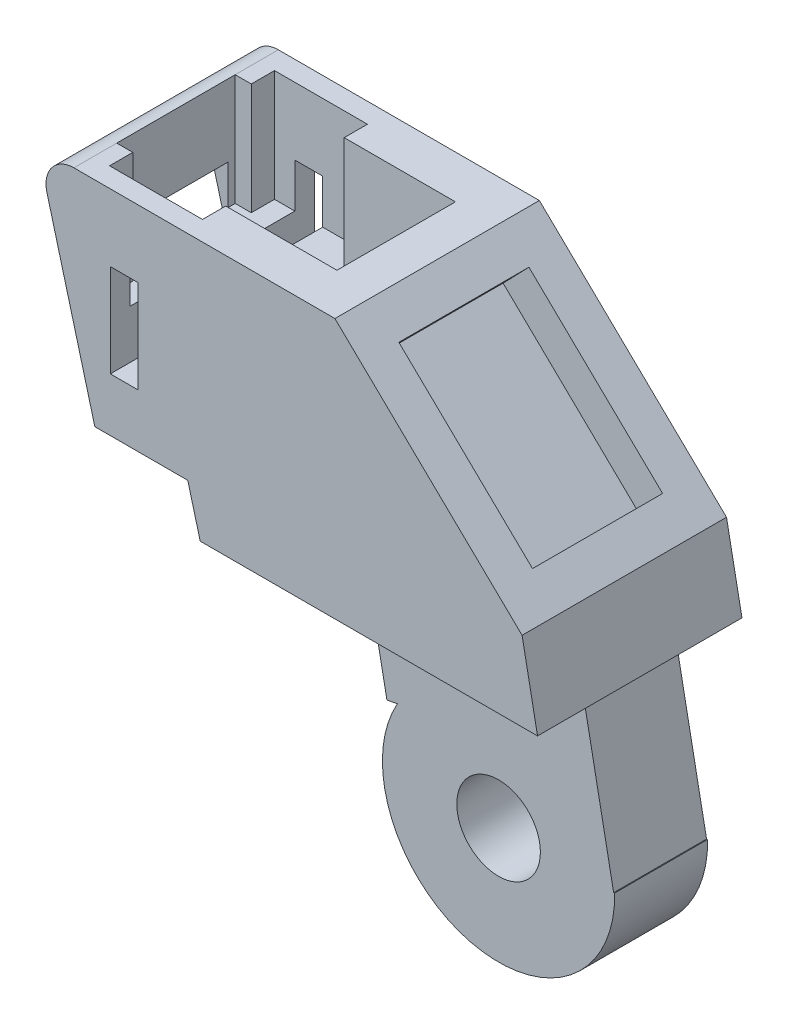
from build123d import *

# Parameters (mm, degrees)
SKETCH1_R                = 12.499992756
SKETCH1_R_2              = 4.5
BOSS_EXTRUDE1_DEPTH      = 10
BOSS_EXTRUDE2_DEPTH      = 11
BOSS_EXTRUDE2_DEPTH_BACK = 11
SKETCH7_W                = 11.132946344
SKETCH7_H                = 10.716090789
CUT_EXTRUDE1_DEPTH       = 24
CUT_EXTRUDE2_DEPTH       = 12
SKETCH9_W                = 20
SKETCH9_H                = 14
CUT_EXTRUDE3_DEPTH       = 4
SKETCH11_W               = 3
SKETCH11_H               = 10
CUT_EXTRUDE6_DEPTH       = 29
CUT_EXTRUDE7_DEPTH       = 6
CUT_EXTRUDE8_DEPTH       = 6
SKETCH14_W               = 10
SKETCH14_H               = 16.627390186
CUT_EXTRUDE11_DEPTH      = 1


with BuildPart() as part:
    # Sketch1 → Boss-Extrude1 (new body)
    with BuildSketch(Plane.XY):
        with Locations((-2.359227986, 3.370325694)):
            Circle(SKETCH1_R)
        with Locations((-2.359227986, 3.370325694)):
            Circle(SKETCH1_R_2, mode=Mode.SUBTRACT)
    extrude(amount=BOSS_EXTRUDE1_DEPTH)

    # Sketch2 → Boss-Extrude2 (add, two sides: drawn at the far end of the back side and taken through both)
    with BuildSketch(Plane.XY.offset(5).offset(-BOSS_EXTRUDE2_DEPTH_BACK)):
        with BuildLine():
            Line((-16.466638632, 20.051877412), (-14.375085898, 9.29175702))
            Line((-14.375085898, 9.29175702), (-13.02590258, 9.55401134))
            ThreePointArc((-13.02590258, 9.55401134), (-0.090713324, 14.688621829), (10.07529252, 5.184113893))
            Line((10.07529252, 5.184113893), (10.656286173, 5.533200654))
            Line((10.656286173, 5.533200654), (6.172277384, 28.601437959))
            Line((6.172277384, 28.601437959), (-13.969202109, 48.051877412))
            Line((-13.969202109, 48.051877412), (-42.05953414, 48.051877412))
            ThreePointArc((-42.05953414, 48.051877412), (-44.439585044, 46.878168187), (-44.957305605, 44.275438644))
            Line((-44.957305605, 44.275438644), (-39.806421347, 25.051869783))
            Line((-39.806421347, 25.051869783), (-29.806421347, 25.051869783))
            Line((-29.806421347, 25.051869783), (-28.466638632, 20.051877412))
            Line((-28.466638632, 20.051877412), (-16.466638632, 20.051877412))
        make_face()
    extrude(amount=BOSS_EXTRUDE2_DEPTH + BOSS_EXTRUDE2_DEPTH_BACK)

    # Sketch7 → Cut-Extrude1 (cut)
    with BuildSketch(Plane(origin=(-30.87704133, -8.273389154, 0), x_dir=(0, 0, 1), z_dir=(-0.9659265233912161, -0.2588164434678725, 0))):
        with Locations((5, 44.451666175)):
            Rectangle(SKETCH7_W, SKETCH7_H)
    extrude(amount=-CUT_EXTRUDE1_DEPTH, mode=Mode.SUBTRACT)

    # Sketch8 → Cut-Extrude2 (cut)
    with BuildSketch(Plane(origin=(0, 48.051877412, 0), x_dir=(1, 0, 0), z_dir=(0, 1, 0))):
        Polygon((-42.05953414, 1.356763346), (-42.05953414, -11.393238561), (-40.329492636, -11.393238561), (-40.329492636, -13.893238561), (-30.329492636, -13.893238561), (-30.329492636, -11.393238561), (-18.359521933, -11.393238561), (-18.359521933, 1.356763346), (-30.329492636, 1.356763346), (-30.329492636, 3.856761439), (-40.329492636, 3.856761439), (-40.329492636, 1.356763346), align=None)
    extrude(amount=-CUT_EXTRUDE2_DEPTH, mode=Mode.SUBTRACT)

    # Sketch9 → Cut-Extrude3 (cut)
    with BuildSketch(Plane(origin=(17.270448516, 17.884037296, 0), x_dir=(0.7193391079113861, -0.6946590874877052, 0), z_dir=(0.6946590874877052, 0.7193391079113861, 0))):
        with Locations((-29.428277492, -5)):
            Rectangle(SKETCH9_W, SKETCH9_H)
    extrude(amount=-CUT_EXTRUDE3_DEPTH, mode=Mode.SUBTRACT)

    # Sketch11 → Cut-Extrude6 (cut)
    with BuildSketch(Plane.XY.offset(16)):
        with Locations((-36.641862234, 35.805951308)):
            Rectangle(SKETCH11_W, SKETCH11_H)
    extrude(amount=-CUT_EXTRUDE6_DEPTH, mode=Mode.SUBTRACT)

    # Sketch12 → Cut-Extrude7 (cut)
    with BuildSketch(Plane(origin=(0, 0, -6), x_dir=(-1, 0, 0), z_dir=(0, 0, -1))):
        with BuildLine():
            Line((-11.615804928, 5.778217556), (-10.049600589, 4.877240525))
            ThreePointArc((-10.049600589, 4.877240525), (0.290903423, 13.095654553), (13.015538376, 9.552771876))
            Line((13.015538376, 9.552771876), (14.90302776, 9.185881295))
            Line((14.90302776, 9.185881295), (17.014921429, 20.050637947))
            Line((17.014921429, 20.050637947), (-8.841528869, 20.050637947))
            Line((-8.841528869, 20.050637947), (-11.615804928, 5.778217556))
        make_face()
    extrude(amount=-CUT_EXTRUDE7_DEPTH, mode=Mode.SUBTRACT)

    # Sketch13 → Cut-Extrude8 (cut)
    with BuildSketch(Plane.XY.offset(16)):
        with BuildLine():
            Line((-13.02590258, 9.55401134), (-14.375085898, 9.29175702))
            Line((-14.375085898, 9.29175702), (-16.466638632, 20.051877412))
            Line((-16.466638632, 20.051877412), (7.83414275, 20.051877412))
            Line((7.83414275, 20.051877412), (10.656286173, 5.533200654))
            Line((10.656286173, 5.533200654), (10.07529252, 5.184113893))
            ThreePointArc((10.07529252, 5.184113893), (-0.363045865, 13.248952536), (-13.02590258, 9.55401134))
        make_face()
    extrude(amount=-CUT_EXTRUDE8_DEPTH, mode=Mode.SUBTRACT)

    # Sketch14 → Cut-Extrude11 (cut)
    with BuildSketch(Plane(origin=(11.304697945, 2.197409549, 0), x_dir=(0, 0, -1), z_dir=(0.9816272018550709, 0.1908089006786217, 0))):
        with Locations((-5, 9.874949057)):
            Rectangle(SKETCH14_W, SKETCH14_H)
    extrude(amount=-CUT_EXTRUDE11_DEPTH, mode=Mode.SUBTRACT)


solid = part.part
